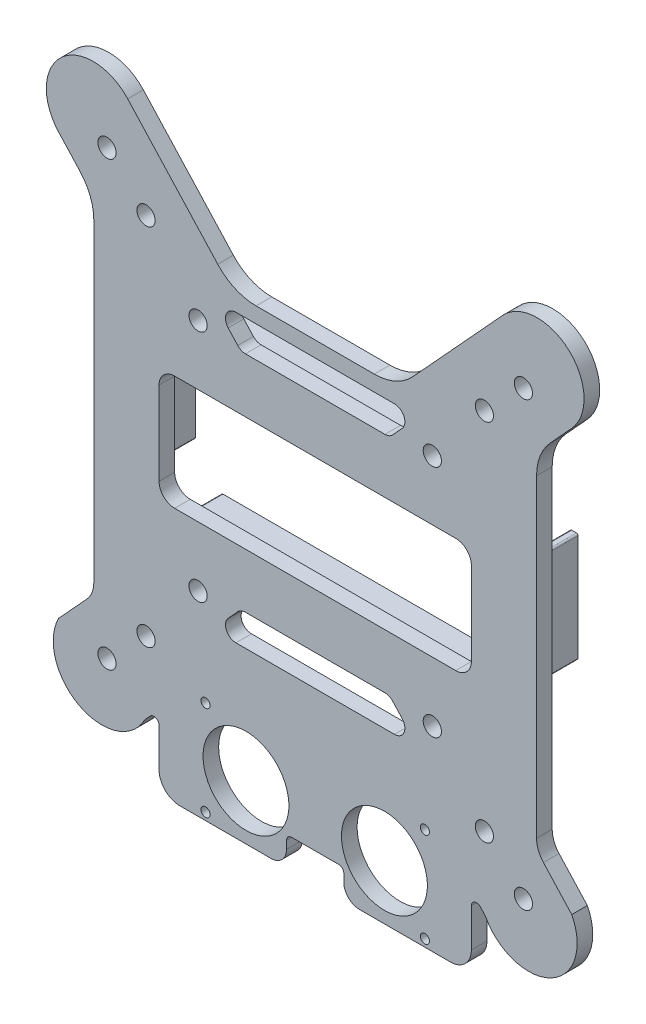
from build123d import *

# Parameters (mm, degrees)
CROQUIS1_W              = 110
CROQUIS1_H              = 120
CROQUIS1_R              = 1.5
CROQUIS1_R_2            = 1.75
SALIENTE_EXTRUIR1_DEPTH = 3
CROQUIS4_R              = 1.75
CROQUIS4_R_2            = 1.5
CORTAR_EXTRUIR2_DEPTH   = 10
SALIENTE_EXTRUIR2_DEPTH = 10
CORTAR_EXTRUIR3_DEPTH   = 10
CROQUIS7_R              = 0.875
CROQUIS7_R_2            = 8.25
CORTAR_EXTRUIR5_DEPTH   = 10
REDONDEO4_R             = 3
CORTAR_EXTRUIR6_DEPTH   = 10


with BuildPart() as part:
    # Croquis1 → Saliente-Extruir1 (new body)
    with BuildSketch(Plane.XY):
        with Locations((55, 60)):
            Rectangle(CROQUIS1_W, CROQUIS1_H)
        with Locations((32.5, 82.5)):
            Circle(CROQUIS1_R, mode=Mode.SUBTRACT)
        with Locations(Location((77.5, 82.5, 0), (0, 0, 180))):
            Circle(CROQUIS1_R, mode=Mode.SUBTRACT)
        with Locations((77.5, 37.5)):
            Circle(CROQUIS1_R, mode=Mode.SUBTRACT)
        with Locations(Location((32.5, 37.5, 0), (0, 0, 180))):
            Circle(CROQUIS1_R, mode=Mode.SUBTRACT)
        with Locations((95, 17.5)):
            Circle(CROQUIS1_R_2, mode=Mode.SUBTRACT)
        with Locations((87.5, 25)):
            Circle(CROQUIS1_R_2, mode=Mode.SUBTRACT)
        with Locations(Location((22.5, 25, 0), (0, 0, 180))):
            Circle(CROQUIS1_R_2, mode=Mode.SUBTRACT)
        with Locations(Location((15, 17.5, 0), (0, 0, 180))):
            Circle(CROQUIS1_R_2, mode=Mode.SUBTRACT)
        with Locations(Location((87.5, 95, 0), (0, 0, 180))):
            Circle(CROQUIS1_R_2, mode=Mode.SUBTRACT)
        with Locations(Location((95, 102.5, 0), (0, 0, 180))):
            Circle(CROQUIS1_R_2, mode=Mode.SUBTRACT)
        with Locations((15, 102.5)):
            Circle(CROQUIS1_R_2, mode=Mode.SUBTRACT)
        with Locations((22.5, 95)):
            Circle(CROQUIS1_R_2, mode=Mode.SUBTRACT)
    extrude(amount=SALIENTE_EXTRUIR1_DEPTH)

    # Croquis4 → Cortar-Extruir2 (cut)
    # profile 1 of 4: a face of its own
    with BuildSketch(Plane(origin=(0, 0, 0), x_dir=(-1, 0, 0), z_dir=(0, 0, -1))):
        with Locations((-32.5, 82.5)):
            Circle(CROQUIS4_R)
        with Locations((-32.5, 82.5)):
            Circle(CROQUIS4_R_2, mode=Mode.SUBTRACT)
    # profile 2 of 4: a face of its own
    with BuildSketch(Plane(origin=(0, 0, 0), x_dir=(-1, 0, 0), z_dir=(0, 0, -1))):
        with Locations((-32.5, 37.5)):
            Circle(CROQUIS4_R)
        with Locations((-32.5, 37.5)):
            Circle(CROQUIS4_R_2, mode=Mode.SUBTRACT)
    # profile 3 of 4: a face of its own
    with BuildSketch(Plane(origin=(0, 0, 0), x_dir=(-1, 0, 0), z_dir=(0, 0, -1))):
        with Locations((-77.5, 82.5)):
            Circle(CROQUIS4_R)
        with Locations((-77.5, 82.5)):
            Circle(CROQUIS4_R_2, mode=Mode.SUBTRACT)
    # profile 4 of 4: a face of its own
    with BuildSketch(Plane(origin=(0, 0, 0), x_dir=(-1, 0, 0), z_dir=(0, 0, -1))):
        with Locations((-77.5, 37.5)):
            Circle(CROQUIS4_R)
        with Locations((-77.5, 37.5)):
            Circle(CROQUIS4_R_2, mode=Mode.SUBTRACT)
    extrude(amount=-CORTAR_EXTRUIR2_DEPTH, mode=Mode.SUBTRACT)

    # Croquis5 → Saliente-Extruir2 (add)
    with BuildSketch(Plane(origin=(0, 0, 0), x_dir=(-1, 0, 0), z_dir=(0, 0, -1))):
        with BuildLine():
            Line((-22.5, 78), (-22.5, 77.5))
            ThreePointArc((-22.5, 77.5), (-22.646446609, 77.146446609), (-23, 77))
            Line((-23, 77), (-77, 77))
            ThreePointArc((-77, 77), (-77.353553391, 77.146446609), (-77.5, 77.5))
            Line((-77.5, 77.5), (-77.5, 78))
            ThreePointArc((-77.5, 78), (-77.353553391, 78.353553391), (-77, 78.5))
            Line((-77, 78.5), (-23, 78.5))
            ThreePointArc((-23, 78.5), (-22.646446609, 78.353553391), (-22.5, 78))
        make_face()
        with BuildLine():
            Line((-92.2, 49.5), (-91.3, 49.5))
            ThreePointArc((-91.3, 49.5), (-91.087867966, 49.587867966), (-91, 49.8))
            Line((-91, 49.8), (-91, 70.2))
            ThreePointArc((-91, 70.2), (-91.087867966, 70.412132034), (-91.3, 70.5))
            Line((-91.3, 70.5), (-92.2, 70.5))
            ThreePointArc((-92.2, 70.5), (-92.412132034, 70.412132034), (-92.5, 70.2))
            Line((-92.5, 70.2), (-92.5, 49.8))
            ThreePointArc((-92.5, 49.8), (-92.412132034, 49.587867966), (-92.2, 49.5))
        make_face()
        with BuildLine():
            Line((-17.5, 70.2), (-17.5, 49.8))
            ThreePointArc((-17.5, 49.8), (-17.587867966, 49.587867966), (-17.8, 49.5))
            Line((-17.8, 49.5), (-18.7, 49.5))
            ThreePointArc((-18.7, 49.5), (-18.912132034, 49.587867966), (-19, 49.8))
            Line((-19, 49.8), (-19, 70.2))
            ThreePointArc((-19, 70.2), (-18.912132034, 70.412132034), (-18.7, 70.5))
            Line((-18.7, 70.5), (-17.8, 70.5))
            ThreePointArc((-17.8, 70.5), (-17.587867966, 70.412132034), (-17.5, 70.2))
        make_face()
        with BuildLine():
            Line((-76, 42.7), (-76, 41.8))
            ThreePointArc((-76, 41.8), (-75.912132034, 41.587867966), (-75.7, 41.5))
            Line((-75.7, 41.5), (-24.3, 41.5))
            ThreePointArc((-24.3, 41.5), (-24.087867966, 41.587867966), (-24, 41.8))
            Line((-24, 41.8), (-24, 42.7))
            ThreePointArc((-24, 42.7), (-24.087867966, 42.912132034), (-24.3, 43))
            Line((-24.3, 43), (-75.7, 43))
            ThreePointArc((-75.7, 43), (-75.912132034, 42.912132034), (-76, 42.7))
        make_face()
    extrude(amount=SALIENTE_EXTRUIR2_DEPTH)

    # Croquis6 → Cortar-Extruir3 (cut)
    with BuildSketch(Plane(origin=(0, 0, 0), x_dir=(-1, 0, 0), z_dir=(0, 0, -1))):
        with BuildLine():
            Line((-82, 71), (-28, 71))
            ThreePointArc((-28, 71), (-25.878679656, 70.121320344), (-25, 68))
            Line((-25, 68), (-25, 52))
            ThreePointArc((-25, 52), (-25.878679656, 49.878679656), (-28, 49))
            Line((-28, 49), (-82, 49))
            ThreePointArc((-82, 49), (-84.121320344, 49.878679656), (-85, 52))
            Line((-85, 52), (-85, 68))
            ThreePointArc((-85, 68), (-84.121320344, 70.121320344), (-82, 71))
        make_face()
        with BuildLine():
            Line((-71.709897982, 84.148550743), (-69.876564649, 82.148550743))
            ThreePointArc((-69.876564649, 82.148550743), (-69.207582851, 81.669303614), (-68.402256369, 81.5))
            Line((-68.402256369, 81.5), (-41.597743631, 81.5))
            ThreePointArc((-41.597743631, 81.5), (-40.792417149, 81.669303614), (-40.123435351, 82.148550743))
            Line((-40.123435351, 82.148550743), (-38.290102018, 84.148550743))
            ThreePointArc((-38.290102018, 84.148550743), (-37.933713912, 86.305326482), (-39.764410298, 87.5))
            Line((-39.764410298, 87.5), (-70.235589702, 87.5))
            ThreePointArc((-70.235589702, 87.5), (-72.066286088, 86.305326482), (-71.709897982, 84.148550743))
        make_face()
        with BuildLine():
            Line((-39.764410298, 32.5), (-70.235589702, 32.5))
            ThreePointArc((-70.235589702, 32.5), (-72.066286088, 33.694673518), (-71.709897982, 35.851449257))
            Line((-71.709897982, 35.851449257), (-69.876564649, 37.851449257))
            ThreePointArc((-69.876564649, 37.851449257), (-69.207582851, 38.330696386), (-68.402256369, 38.5))
            Line((-68.402256369, 38.5), (-41.597743631, 38.5))
            ThreePointArc((-41.597743631, 38.5), (-40.792417149, 38.330696386), (-40.123435351, 37.851449257))
            Line((-40.123435351, 37.851449257), (-38.290102018, 35.851449257))
            ThreePointArc((-38.290102018, 35.851449257), (-37.933713912, 33.694673518), (-39.764410298, 32.5))
        make_face()
    extrude(amount=-CORTAR_EXTRUIR3_DEPTH, mode=Mode.SUBTRACT)

    # Croquis7 → Cortar-Extruir5 (cut)
    with BuildSketch(Plane(origin=(0, 0, 0), x_dir=(-1, 0, 0), z_dir=(0, 0, -1))):
        with BuildLine():
            Line((-60.5, 0), (-49.5, 0))
            Line((-49.5, 0), (-49.5, 4.5))
            ThreePointArc((-49.5, 4.5), (-49.792893219, 5.207106781), (-50.5, 5.5))
            Line((-50.5, 5.5), (-59.5, 5.5))
            ThreePointArc((-59.5, 5.5), (-60.207106781, 5.207106781), (-60.5, 4.5))
            Line((-60.5, 4.5), (-60.5, 0))
        make_face()
        with Locations((-76.075, 19.575)):
            Circle(CROQUIS7_R)
        with Locations((-76.075, 1.425)):
            Circle(CROQUIS7_R)
        with Locations((-33.925, 1.425)):
            Circle(CROQUIS7_R)
        with Locations((-33.925, 19.575)):
            Circle(CROQUIS7_R)
        with Locations((-68.3, 10.5)):
            Circle(CROQUIS7_R_2)
        with Locations((-41.7, 10.5)):
            Circle(CROQUIS7_R_2)
    extrude(amount=-CORTAR_EXTRUIR5_DEPTH, mode=Mode.SUBTRACT)

    # Redondeo4
    redondeo4_edges = [part.edges().sort_by_distance(p)[0] for p in [
        (60.5, 0, 1.5),
        (49.5, 0, 1.5),
    ]]
    fillet(redondeo4_edges, radius=REDONDEO4_R)

    # Croquis9 → Cortar-Extruir6 (cut)
    with BuildSketch(Plane(origin=(0, 0, 0), x_dir=(-1, 0, 0), z_dir=(0, 0, -1))):
        with BuildLine():
            Line((-66.350200723, 90.5), (-43.649799277, 90.5))
            ThreePointArc((-43.649799277, 90.5), (-39.623166866, 91.346518071), (-36.278257875, 93.742753715))
            Line((-36.278257875, 93.742753715), (-18.979043258, 112.614624206))
            ThreePointArc((-18.979043258, 112.614624206), (-6.26313434, 113.167489811), (-5.710268735, 100.451580893))
            Line((-5.710268735, 100.451580893), (-9.839056422, 95.94744887))
            ThreePointArc((-9.839056422, 95.94744887), (-11.787263247, 92.815432645), (-12.46751502, 89.190202585))
            Line((-12.46751502, 89.190202585), (-12.46751502, 28.864878962))
            ThreePointArc((-12.46751502, 28.864878962), (-12.127389133, 27.052263932), (-11.153285721, 25.486255819))
            Line((-11.153285721, 25.486255819), (-5.710268735, 19.548419107))
            ThreePointArc((-5.710268735, 19.548419107), (-9.732013396, 6.983331017), (-22.297101486, 11.005075679))
            Line((-22.297101486, 11.005075679), (-23.26284586, 12.058614996))
            ThreePointArc((-23.26284586, 12.058614996), (-24.362523006, 12.31486519), (-25, 11.382890367))
            Line((-25, 11.382890367), (-25, 4))
            ThreePointArc((-25, 4), (-26.171572875, 1.171572875), (-29, 0))
            Line((-29, 0), (0, 0))
            Line((0, 0), (0, 120))
            Line((0, 120), (-110, 120))
            Line((-110, 120), (-110, 0))
            Line((-110, 0), (-81, 0))
            ThreePointArc((-81, 0), (-83.828427125, 1.171572875), (-85, 4))
            Line((-85, 4), (-85, 11.382890367))
            ThreePointArc((-85, 11.382890367), (-85.637476994, 12.31486519), (-86.73715414, 12.058614996))
            Line((-86.73715414, 12.058614996), (-87.702898514, 11.005075679))
            ThreePointArc((-87.702898514, 11.005075679), (-100.267986604, 6.983331017), (-104.289731265, 19.548419107))
            Line((-104.289731265, 19.548419107), (-98.846714279, 25.486255819))
            ThreePointArc((-98.846714279, 25.486255819), (-97.872610867, 27.052263932), (-97.53248498, 28.864878962))
            Line((-97.53248498, 28.864878962), (-97.53248498, 89.190202585))
            ThreePointArc((-97.53248498, 89.190202585), (-98.212736753, 92.815432645), (-100.160943578, 95.94744887))
            Line((-100.160943578, 95.94744887), (-104.289731265, 100.451580893))
            ThreePointArc((-104.289731265, 100.451580893), (-103.73686566, 113.167489811), (-91.020956742, 112.614624206))
            Line((-91.020956742, 112.614624206), (-73.721742125, 93.742753715))
            ThreePointArc((-73.721742125, 93.742753715), (-70.376833134, 91.346518071), (-66.350200723, 90.5))
        make_face()
    extrude(amount=-CORTAR_EXTRUIR6_DEPTH, mode=Mode.SUBTRACT)


solid = part.part
